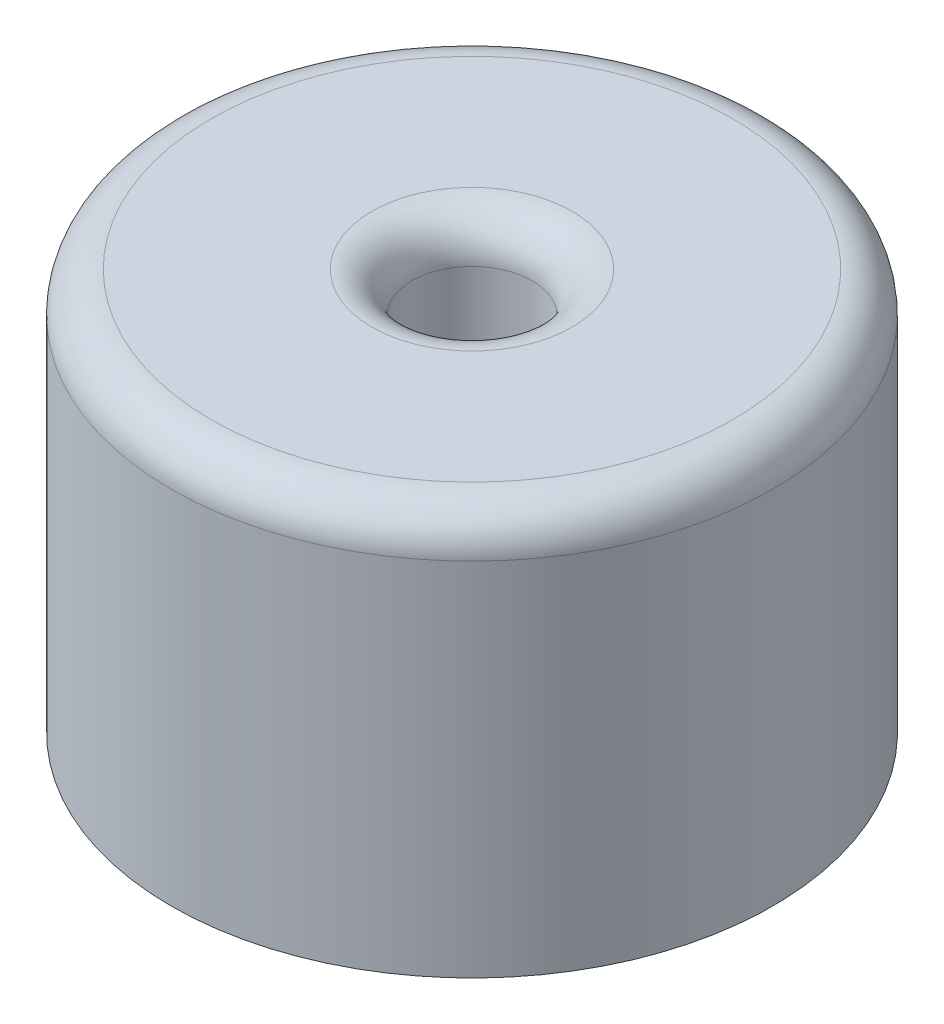
from build123d import *

# Parameters (mm, degrees)
SKETCH3_R           = 19.05
BOSS_EXTRUDE1_DEPTH = 25.4
SKETCH4_R           = 3.81
CUT_EXTRUDE1_DEPTH  = 25.4
FILLET1_R           = 2.54


with BuildPart() as part:
    # Sketch3 → Boss-Extrude1 (new body)
    with BuildSketch(Plane(origin=(0, 0, 0), x_dir=(1, 0, 0), z_dir=(0, 1, 0))):
        with Locations(Location((0, 0, 0), (0, 0, 270))):
            Circle(SKETCH3_R)
    extrude(amount=BOSS_EXTRUDE1_DEPTH)

    # Sketch4 → Cut-Extrude1 (cut)
    with BuildSketch(Plane(origin=(0, 25.4, 0), x_dir=(1, 0, 0), z_dir=(0, 1, 0))):
        with Locations(Location((0, 0, 0), (0, 0, 270))):
            Circle(SKETCH4_R)
    extrude(amount=-CUT_EXTRUDE1_DEPTH, mode=Mode.SUBTRACT)

    # Fillet1
    fillet1_edges = [part.edges().sort_by_distance(p)[0] for p in [
        (0, 25.4, -19.05),
        (0, 0, -3.81),
        (0, 25.4, -3.81),
    ]]
    fillet(fillet1_edges, radius=FILLET1_R)


solid = part.part
